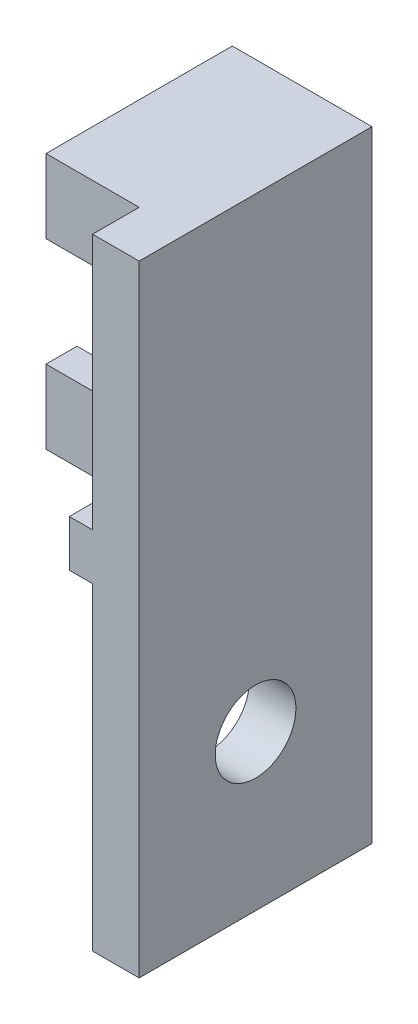
from build123d import *

# Parameters (mm, degrees)
SKETCH1_W           = 15
SKETCH1_H           = 40
SKETCH1_R           = 2.6
BOSS_EXTRUDE1_DEPTH = 3
SKETCH2_W           = 15
SKETCH2_H           = 3
BOSS_EXTRUDE2_DEPTH = 1.5
BOSS_EXTRUDE3_DEPTH = 6
SKETCH4_W           = 2
SKETCH4_H           = 7
CUT_EXTRUDE1_DEPTH  = 6


with BuildPart() as part:
    # Sketch1 → Boss-Extrude1 (new body)
    with BuildSketch(Plane(origin=(0, 0, 0), x_dir=(0, 0, -1), z_dir=(1, 0, 0))):
        with Locations((7.5, 20)):
            Rectangle(SKETCH1_W, SKETCH1_H)
        with Locations((7.5, 10)):
            Circle(SKETCH1_R, mode=Mode.SUBTRACT)
    extrude(amount=BOSS_EXTRUDE1_DEPTH)

    # Sketch2 → Boss-Extrude2 (add)
    with BuildSketch(Plane.ZY):
        with Locations((-7.5, 22)):
            Rectangle(SKETCH2_W, SKETCH2_H)
    extrude(amount=BOSS_EXTRUDE2_DEPTH)

    # Sketch3 → Boss-Extrude3 (add)
    with BuildSketch(Plane.ZY):
        Polygon((-15, 25), (-5, 25), (-5, 38.5), (-15, 38.5), (-15, 40), (-3, 40), (-3, 23.5), (-15, 23.5), align=None)
    extrude(amount=BOSS_EXTRUDE3_DEPTH)

    # Sketch4 → Cut-Extrude1 (cut)
    with BuildSketch(Plane.ZY.offset(6)):
        with Locations((-4, 31.75)):
            Rectangle(SKETCH4_W, SKETCH4_H)
    extrude(amount=-CUT_EXTRUDE1_DEPTH, mode=Mode.SUBTRACT)


solid = part.part
